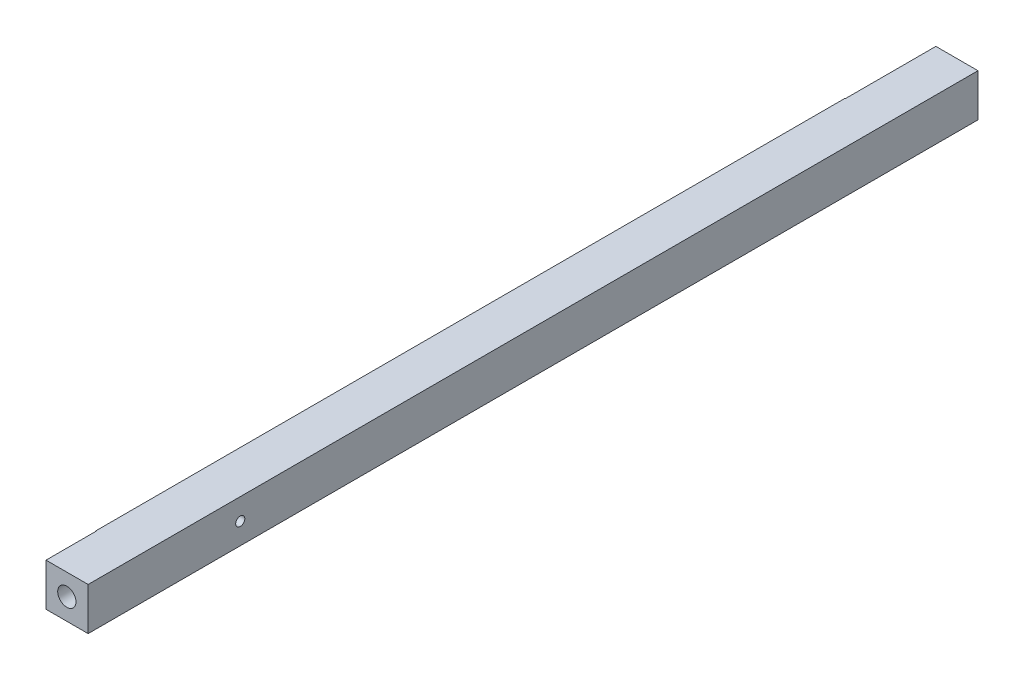
from build123d import *

# Parameters (mm, degrees)
IZIM1_W                     = 28
IZIM1_H                     = 28
Y_KSEKLIK_EKSTR_ZYON1_DEPTH = 585
IZIM2_R                     = 6
KES_EKSTR_ZYON1_DEPTH       = 60
SKETCH1_R                   = 3
CUT_EXTRUDE1_DEPTH          = 10
SKETCH2_R                   = 3
CUT_EXTRUDE2_DEPTH          = 586.837008049
SKETCH3_R                   = 4.25
CUT_EXTRUDE3_DEPTH          = 6
SKETCH4_W                   = 79.561179617
SKETCH4_H                   = 84.218096563
SKETCH4_W_2                 = 144.712868034
SKETCH4_H_2                 = 206.469543182
CUT_EXTRUDE4_DEPTH          = 0.3


with BuildPart() as part:
    # Çizim1 → Yükseklik-Ekstrüzyon1 (new body)
    with BuildSketch(Plane.XY):
        Rectangle(IZIM1_W, IZIM1_H)
    extrude(amount=Y_KSEKLIK_EKSTR_ZYON1_DEPTH)

    # Çizim2 → Kes-Ekstrüzyon1 (cut)
    with BuildSketch(Plane.XY.offset(585)):
        Circle(IZIM2_R)
    extrude(amount=-KES_EKSTR_ZYON1_DEPTH, mode=Mode.SUBTRACT)

    # Sketch1 → Cut-Extrude1 (cut)
    with BuildSketch(Plane(origin=(0, 0, 0), x_dir=(-1, 0, 0), z_dir=(0, 0, -1))):
        with Locations((-7, -7)):
            Circle(SKETCH1_R)
        with Locations((7, 7)):
            Circle(SKETCH1_R)
    extrude(amount=-CUT_EXTRUDE1_DEPTH, mode=Mode.SUBTRACT)

    # Sketch2 → Cut-Extrude2 (cut, through all)
    with BuildSketch(Plane.ZY.offset(14)):
        with Locations((485, 0)):
            Circle(SKETCH2_R)
    extrude(amount=-CUT_EXTRUDE2_DEPTH, mode=Mode.SUBTRACT)

    # Sketch3 → Cut-Extrude3 (cut)
    with BuildSketch(Plane.ZY.offset(14)):
        with Locations((485, 0)):
            Circle(SKETCH3_R)
    extrude(amount=-CUT_EXTRUDE3_DEPTH, mode=Mode.SUBTRACT)

    # Sketch4 → Cut-Extrude4 (cut)
    with BuildSketch(Plane.ZY.offset(14)):
        with Locations((591.780589809, 6.31374468)):
            Rectangle(SKETCH4_W, SKETCH4_H)
        with Locations((-12.856434017, 14.64786351)):
            Rectangle(SKETCH4_W_2, SKETCH4_H_2)
    extrude(amount=-CUT_EXTRUDE4_DEPTH, mode=Mode.SUBTRACT)


solid = part.part
